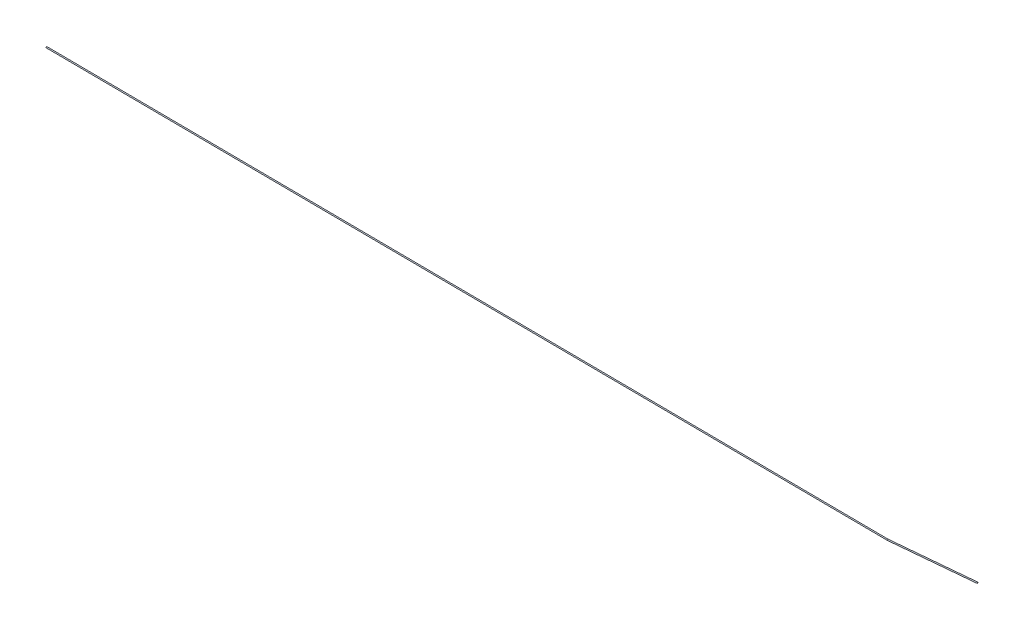
from build123d import *

# Parameters (mm, degrees)
SWEEP1_PROFILE_R = 0.41


with BuildPart() as part:
    # Sweep1: sweep along a curve in space
    with BuildLine() as sweep1_path:
        Line((-599.874979588, 90.051845583, 68.126324969), (63.698066841, 84.452816353, 67.267210553))
        Line((63.698066841, 84.452816353, 67.267210553), (128.983388504, 85.022964554, 61.800857925))
    # Sweep1 profile (on start of the path) → Sweep1 (sweep)
    with BuildSketch(Plane(origin=(-599.874979588, 90.051845583, 68.126324969), x_dir=(0.008437398053026807, 0.9999644045235284, 0), z_dir=(0.9999635665165794, -0.008437390982176917, -0.0012946323248253034))):
        Circle(SWEEP1_PROFILE_R)
    sweep(path=sweep1_path.line, transition=Transition.RIGHT)


solid = part.part
